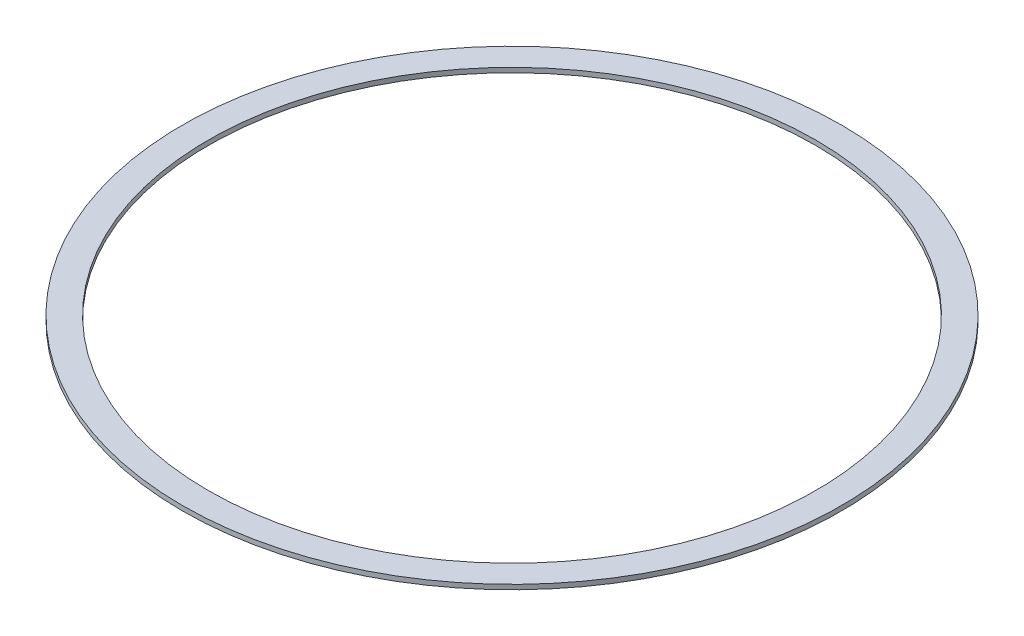
from build123d import *

# Parameters (mm, degrees)
SKETCH_1_R      = 35
SKETCH_1_R_2    = 32.25
EXTRUDE_1_DEPTH = 0.5


with BuildPart() as part:
    # 草图1 → 凸台-拉伸1 (new body)
    with BuildSketch(Plane(origin=(0, 0, 0), x_dir=(1, 0, 0), z_dir=(0, 1, 0))):
        with Locations(Location((0, 0, 0), (0, 0, 270))):
            Circle(SKETCH_1_R)
        with Locations(Location((0, 0, 0), (0, 0, 270))):
            Circle(SKETCH_1_R_2, mode=Mode.SUBTRACT)
    extrude(amount=EXTRUDE_1_DEPTH)


solid = part.part
